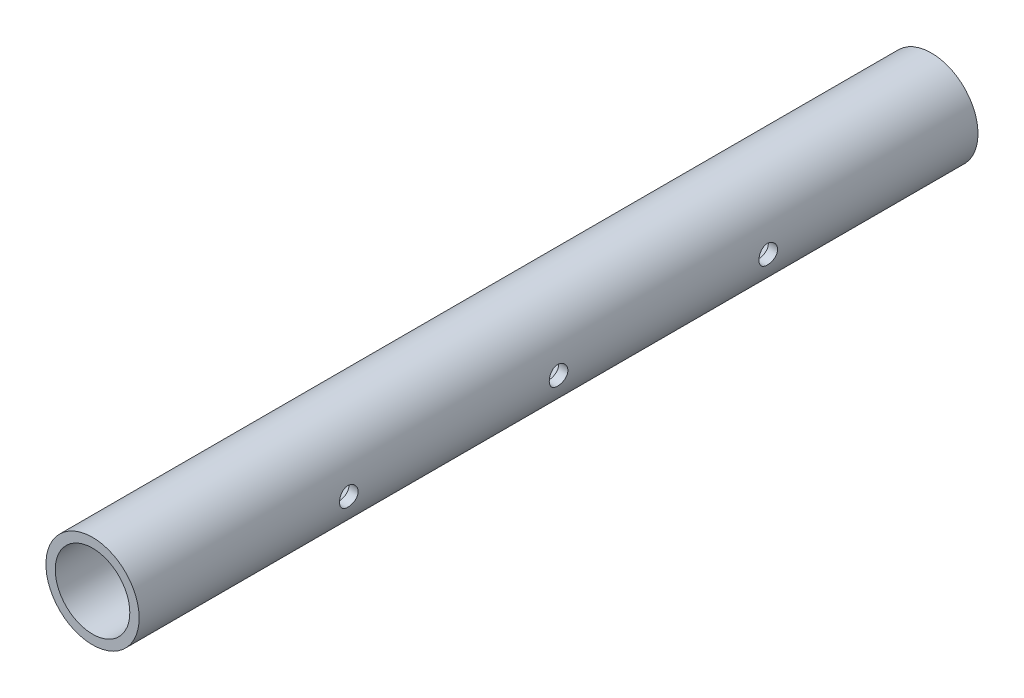
from build123d import *

# Parameters (mm, degrees)
SKETCH1_R               = 25
SKETCH1_R_2             = 20
BOSS_EXTRUDE1_DEPTH     = 450
CUT_EXTRUDE2_DEPTH      = 452.386752132
CUT_EXTRUDE2_DEPTH_BACK = 452.386752132
SKETCH2_R               = 5


with BuildPart() as part:
    # Sketch1 → Boss-Extrude1 (new body)
    with BuildSketch(Plane.XY):
        Circle(SKETCH1_R)
        Circle(SKETCH1_R_2, mode=Mode.SUBTRACT)
    extrude(amount=BOSS_EXTRUDE1_DEPTH)

    # Sketch2 → Cut-Extrude2 (cut, two sides: drawn at the far end of the back side and taken through both)
    with BuildSketch(Plane(origin=(0, 0, 0), x_dir=(0, 0, -1), z_dir=(1, 0, 0)).offset(-CUT_EXTRUDE2_DEPTH_BACK)):
        with Locations((-337.5, 0)):
            Circle(SKETCH2_R)
        with Locations((-225, 0)):
            Circle(SKETCH2_R)
        with Locations((-112.5, 0)):
            Circle(SKETCH2_R)
    extrude(amount=CUT_EXTRUDE2_DEPTH + CUT_EXTRUDE2_DEPTH_BACK, mode=Mode.SUBTRACT)


solid = part.part
